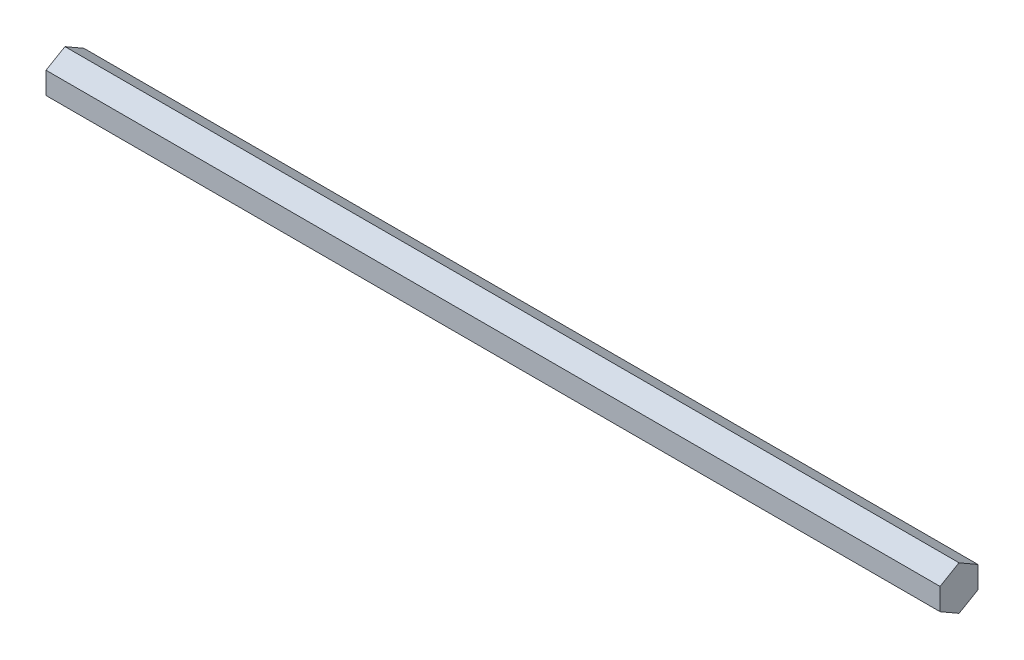
from build123d import *

# Parameters (mm, degrees)
AXLE_DEPTH = 194.31


with BuildPart() as part:
    # Hex Profile → Axle (new body)
    with BuildSketch(Plane(origin=(0, 0, 0), x_dir=(0, 0, -1), z_dir=(1, 0, 0))):
        Polygon((4.124445986, -2.38125), (4.124445986, 2.38125), (0, 4.7625), (-4.124445986, 2.38125), (-4.124445986, -2.38125), (0, -4.7625), align=None)
    extrude(amount=AXLE_DEPTH)


solid = part.part
